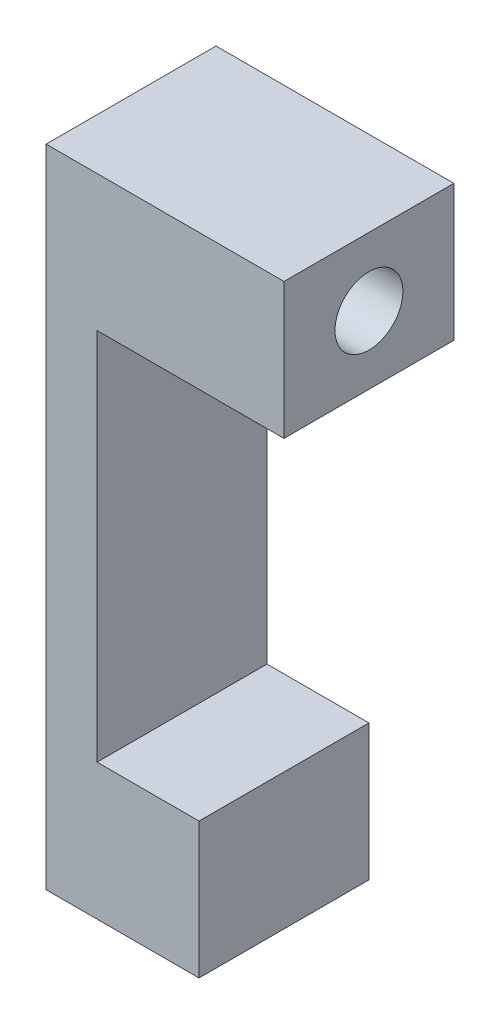
from build123d import *

# Parameters (mm, degrees)
SKETCH1_W           = 50
SKETCH1_H           = 40
SKETCH1_R           = 10
BOSS_EXTRUDE1_DEPTH = 55
BOSS_EXTRUDE2_START = -15
SKETCH1_3_W         = 50
SKETCH1_3_H         = 190
SKETCH1_3_R         = 10
BOSS_EXTRUDE2_DEPTH = 15
SKETCH1_4_W         = 50
SKETCH1_4_H         = 40
BOSS_EXTRUDE3_DEPTH = 30


with BuildPart() as part:
    # Sketch1 → Boss-Extrude1 (new body)
    with BuildSketch(Plane(origin=(0, 0, 0), x_dir=(0, 0, -1), z_dir=(1, 0, 0))):
        with Locations((0, 75)):
            Rectangle(SKETCH1_W, SKETCH1_H)
        with Locations((0, 75)):
            Circle(SKETCH1_R, mode=Mode.SUBTRACT)
    extrude(amount=BOSS_EXTRUDE1_DEPTH)

    # Sketch1<3> → Boss-Extrude2 (add)
    with BuildSketch(Plane(origin=(0, 0, 0), x_dir=(0, 0, -1), z_dir=(1, 0, 0)).offset(BOSS_EXTRUDE2_START)):
        Rectangle(SKETCH1_3_W, SKETCH1_3_H)
        with Locations((0, 75)):
            Circle(SKETCH1_3_R, mode=Mode.SUBTRACT)
    extrude(amount=BOSS_EXTRUDE2_DEPTH)

    # Sketch1<4> → Boss-Extrude3 (add)
    with BuildSketch(Plane(origin=(0, 0, 0), x_dir=(0, 0, -1), z_dir=(1, 0, 0))):
        with Locations((0, -75)):
            Rectangle(SKETCH1_4_W, SKETCH1_4_H)
    extrude(amount=BOSS_EXTRUDE3_DEPTH)


solid = part.part
